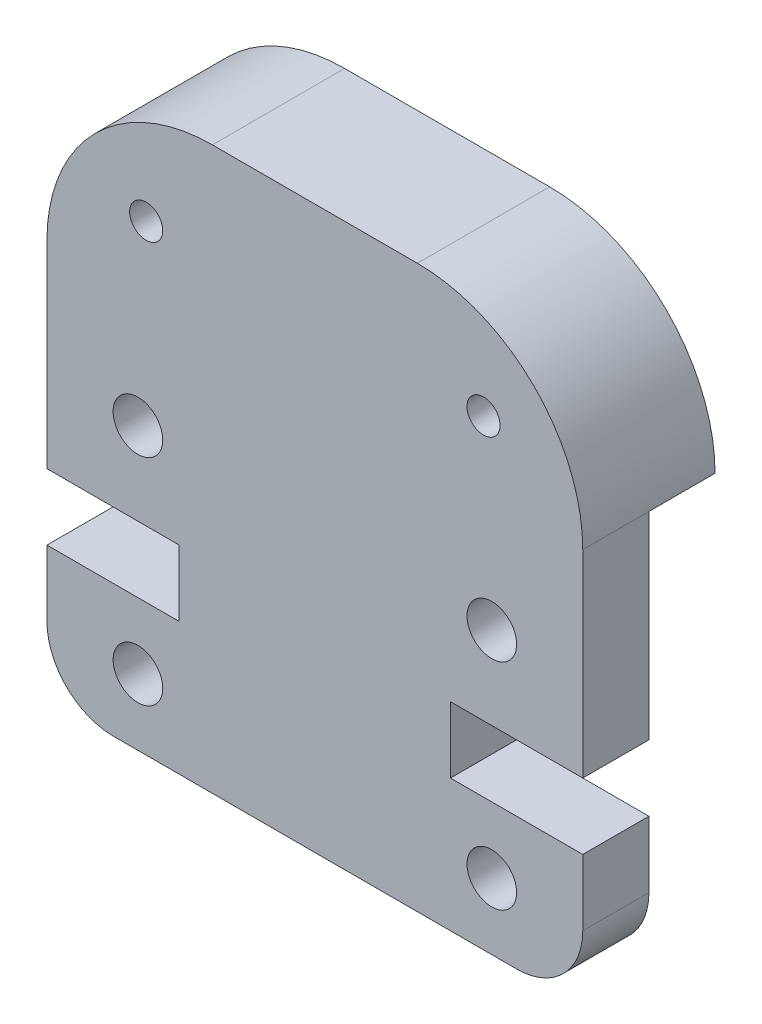
from build123d import *

# Parameters (mm, degrees)
SKETCH1_R           = 0.75
SKETCH1_R_2         = 0.5
BOSS_EXTRUDE1_DEPTH = 4
SKETCH2_W           = 16.2
SKETCH2_H           = 11.98
CUT_EXTRUDE1_DEPTH  = 2


with BuildPart() as part:
    # Sketch1 → Boss-Extrude1 (new body)
    with BuildSketch(Plane.XY):
        with BuildLine():
            Line((3.1, 16.98), (-3.1, 16.98))
            ThreePointArc((-3.1, 16.98), (-6.635533906, 15.515533906), (-8.1, 11.98))
            Line((-8.1, 11.98), (-8.1, 6))
            Line((-8.1, 6), (-4.1, 6))
            Line((-4.1, 6), (-4.1, 4))
            Line((-4.1, 4), (-8.1, 4))
            Line((-8.1, 4), (-8.1, 2))
            ThreePointArc((-8.1, 2), (-7.514213562, 0.585786438), (-6.1, 0))
            Line((-6.1, 0), (6.1, 0))
            ThreePointArc((6.1, 0), (7.514213562, 0.585786438), (8.1, 2))
            Line((8.1, 2), (8.1, 4))
            Line((8.1, 4), (4.1, 4))
            Line((4.1, 4), (4.1, 6))
            Line((4.1, 6), (8.1, 6))
            Line((8.1, 6), (8.1, 11.98))
            ThreePointArc((8.1, 11.98), (6.635533906, 15.515533906), (3.1, 16.98))
        make_face()
        with Locations((-5.35, 2)):
            Circle(SKETCH1_R, mode=Mode.SUBTRACT)
        with Locations((-5.1, 13.98)):
            Circle(SKETCH1_R_2, mode=Mode.SUBTRACT)
        with Locations((-5.35, 8.5)):
            Circle(SKETCH1_R, mode=Mode.SUBTRACT)
        with Locations((5.35, 8.5)):
            Circle(SKETCH1_R, mode=Mode.SUBTRACT)
        with Locations((5.1, 13.98)):
            Circle(SKETCH1_R_2, mode=Mode.SUBTRACT)
        with Locations((5.35, 2)):
            Circle(SKETCH1_R, mode=Mode.SUBTRACT)
    extrude(amount=BOSS_EXTRUDE1_DEPTH)

    # Sketch2 → Cut-Extrude1 (cut)
    with BuildSketch(Plane.XY):
        with Locations((0, 5.99)):
            Rectangle(SKETCH2_W, SKETCH2_H)
    extrude(amount=CUT_EXTRUDE1_DEPTH, mode=Mode.SUBTRACT)


solid = part.part
